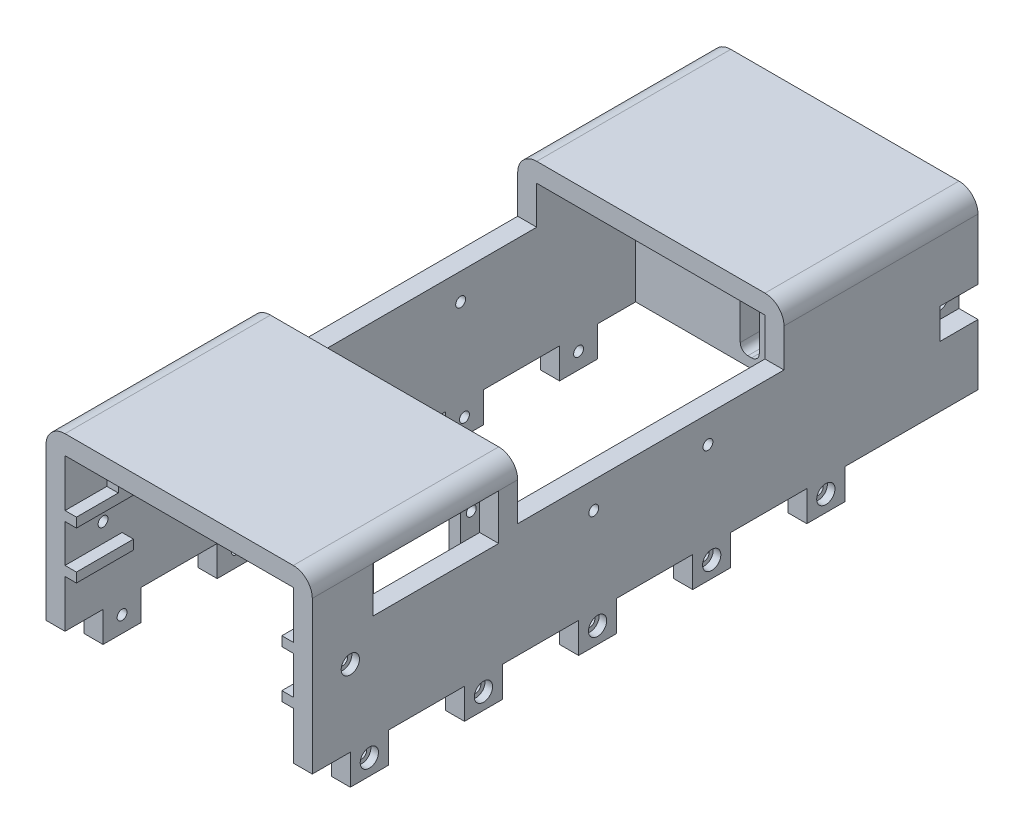
from build123d import *

# Parameters (mm, degrees)
BOSS_EXTRUDE1_DEPTH = 175
SKETCH2_W           = 10
SKETCH2_H           = 8
SKETCH2_R           = 2.4
SKETCH2_R_2         = 1.3
BOSS_EXTRUDE2_DEPTH = 5
SKETCH2_3_R         = 2.4
SKETCH2_3_R_2       = 1.3
CUT_EXTRUDE1_DEPTH  = 2
SKETCH4_W           = 12
SKETCH4_H           = 12
SKETCH4_R           = 1.95
BOSS_EXTRUDE3_DEPTH = 5
SKETCH6_W           = 5
SKETCH6_H           = 8
CUT_EXTRUDE4_DEPTH  = 10
SKETCH7_W           = 70
SKETCH7_H           = 70
CUT_EXTRUDE5_DEPTH  = 15
CUT_EXTRUDE6_REACH  = 204.855
SKETCH9_R           = 1.3
CUT_EXTRUDE15_REACH = 204.855
SKETCH18_R          = 1.3
SKETCH18_3_R        = 2.4
CUT_EXTRUDE16_DEPTH = 2
BOSS_EXTRUDE4_REACH = 195.585
BULKHEAD_W          = 60
BULKHEAD_H          = 10
CUT_EXTRUDE17_REACH = 204.855
SKETCH20_W          = 33
SKETCH20_H          = 12
SKETCH21_W          = 10.1
SKETCH21_H          = 15
SKETCH21_R          = 1.3
BOSS_EXTRUDE6_DEPTH = 3
CUT_EXTRUDE18_DEPTH = 10
SKETCH23_W          = 11
SKETCH23_H          = 2.5
SKETCH23_W_2        = 15
BOSS_EXTRUDE7_DEPTH = 3


with BuildPart() as part:
    # Body Arch → Boss-Extrude1 (new body)
    with BuildSketch(Plane.XY.offset(10)):
        with BuildLine():
            Line((-30, 40), (30, 40))
            Line((30, 40), (30, 0))
            Line((30, 0), (35, 0))
            Line((35, 0), (35, 40))
            ThreePointArc((35, 40), (33.535533906, 43.535533906), (30, 45))
            Line((30, 45), (-30, 45))
            ThreePointArc((-30, 45), (-33.535533906, 43.535533906), (-35, 40))
            Line((-35, 40), (-35, 0))
            Line((-35, 0), (-30, 0))
            Line((-30, 0), (-30, 40))
        make_face()
    extrude(amount=BOSS_EXTRUDE1_DEPTH)

    # Sketch2 → Boss-Extrude2 (add)
    # profile 1 of 10: a face of its own
    with BuildSketch(Plane(origin=(35, 0, 0), x_dir=(0, 0, -1), z_dir=(1, 0, 0))):
        with Locations((-170, -4)):
            Rectangle(SKETCH2_W, SKETCH2_H)
        with Locations((-170, -3.75)):
            Circle(SKETCH2_R, mode=Mode.SUBTRACT)
    # profile 2 of 10: a face of its own
    with BuildSketch(Plane(origin=(35, 0, 0), x_dir=(0, 0, -1), z_dir=(1, 0, 0))):
        with Locations((-140, -4)):
            Rectangle(SKETCH2_W, SKETCH2_H)
        with Locations((-140, -3.75)):
            Circle(SKETCH2_R, mode=Mode.SUBTRACT)
    # profile 3 of 10: a face of its own
    with BuildSketch(Plane(origin=(35, 0, 0), x_dir=(0, 0, -1), z_dir=(1, 0, 0))):
        with Locations((-110, -4)):
            Rectangle(SKETCH2_W, SKETCH2_H)
        with Locations((-110, -3.75)):
            Circle(SKETCH2_R, mode=Mode.SUBTRACT)
    # profile 4 of 10: a face of its own
    with BuildSketch(Plane(origin=(35, 0, 0), x_dir=(0, 0, -1), z_dir=(1, 0, 0))):
        with Locations((-80, -4)):
            Rectangle(SKETCH2_W, SKETCH2_H)
        with Locations((-80, -3.75)):
            Circle(SKETCH2_R, mode=Mode.SUBTRACT)
    # profile 5 of 10: a face of its own
    with BuildSketch(Plane(origin=(35, 0, 0), x_dir=(0, 0, -1), z_dir=(1, 0, 0))):
        with Locations((-50, -4)):
            Rectangle(SKETCH2_W, SKETCH2_H)
        with Locations((-50, -3.75)):
            Circle(SKETCH2_R, mode=Mode.SUBTRACT)
    # profile 6 of 10: a face of its own
    with BuildSketch(Plane(origin=(35, 0, 0), x_dir=(0, 0, -1), z_dir=(1, 0, 0))):
        with Locations((-170, -3.75)):
            Circle(SKETCH2_R)
        with Locations((-170, -3.75)):
            Circle(SKETCH2_R_2, mode=Mode.SUBTRACT)
    # profile 7 of 10: a face of its own
    with BuildSketch(Plane(origin=(35, 0, 0), x_dir=(0, 0, -1), z_dir=(1, 0, 0))):
        with Locations((-140, -3.75)):
            Circle(SKETCH2_R)
        with Locations((-140, -3.75)):
            Circle(SKETCH2_R_2, mode=Mode.SUBTRACT)
    # profile 8 of 10: a face of its own
    with BuildSketch(Plane(origin=(35, 0, 0), x_dir=(0, 0, -1), z_dir=(1, 0, 0))):
        with Locations((-110, -3.75)):
            Circle(SKETCH2_R)
        with Locations((-110, -3.75)):
            Circle(SKETCH2_R_2, mode=Mode.SUBTRACT)
    # profile 9 of 10: a face of its own
    with BuildSketch(Plane(origin=(35, 0, 0), x_dir=(0, 0, -1), z_dir=(1, 0, 0))):
        with Locations((-80, -3.75)):
            Circle(SKETCH2_R)
        with Locations((-80, -3.75)):
            Circle(SKETCH2_R_2, mode=Mode.SUBTRACT)
    # profile 10 of 10: a face of its own
    with BuildSketch(Plane(origin=(35, 0, 0), x_dir=(0, 0, -1), z_dir=(1, 0, 0))):
        with Locations((-50, -3.75)):
            Circle(SKETCH2_R)
        with Locations((-50, -3.75)):
            Circle(SKETCH2_R_2, mode=Mode.SUBTRACT)
    boss_extrude2 = extrude(amount=-BOSS_EXTRUDE2_DEPTH)

    # Sketch2<3> → Cut-Extrude1 (cut)
    # profile 1 of 5: a face of its own
    with BuildSketch(Plane(origin=(35, 0, 0), x_dir=(0, 0, -1), z_dir=(1, 0, 0))):
        with Locations((-170, -3.75)):
            Circle(SKETCH2_3_R)
        with Locations((-170, -3.75)):
            Circle(SKETCH2_3_R_2, mode=Mode.SUBTRACT)
    # profile 2 of 5: a face of its own
    with BuildSketch(Plane(origin=(35, 0, 0), x_dir=(0, 0, -1), z_dir=(1, 0, 0))):
        with Locations((-140, -3.75)):
            Circle(SKETCH2_3_R)
        with Locations((-140, -3.75)):
            Circle(SKETCH2_3_R_2, mode=Mode.SUBTRACT)
    # profile 3 of 5: a face of its own
    with BuildSketch(Plane(origin=(35, 0, 0), x_dir=(0, 0, -1), z_dir=(1, 0, 0))):
        with Locations((-110, -3.75)):
            Circle(SKETCH2_3_R)
        with Locations((-110, -3.75)):
            Circle(SKETCH2_3_R_2, mode=Mode.SUBTRACT)
    # profile 4 of 5: a face of its own
    with BuildSketch(Plane(origin=(35, 0, 0), x_dir=(0, 0, -1), z_dir=(1, 0, 0))):
        with Locations((-80, -3.75)):
            Circle(SKETCH2_3_R)
        with Locations((-80, -3.75)):
            Circle(SKETCH2_3_R_2, mode=Mode.SUBTRACT)
    # profile 5 of 5: a face of its own
    with BuildSketch(Plane(origin=(35, 0, 0), x_dir=(0, 0, -1), z_dir=(1, 0, 0))):
        with Locations((-50, -3.75)):
            Circle(SKETCH2_3_R)
        with Locations((-50, -3.75)):
            Circle(SKETCH2_3_R_2, mode=Mode.SUBTRACT)
    cut_extrude1 = extrude(amount=-CUT_EXTRUDE1_DEPTH, mode=Mode.SUBTRACT)

    # Mirror1: Boss-Extrude2, Cut-Extrude1 across plane
    add(boss_extrude2.mirror(Plane(origin=(0, 0, 0), x_dir=(0, 0, 1), z_dir=(1, 0, 0))))
    add(cut_extrude1.mirror(Plane(origin=(0, 0, 0), x_dir=(0, 0, 1), z_dir=(1, 0, 0))), mode=Mode.SUBTRACT)

    # Sketch4 → Boss-Extrude3 (add)
    with BuildSketch(Plane.ZY.offset(-30)):
        with Locations((16, 20)):
            Rectangle(SKETCH4_W, SKETCH4_H)
        with Locations(Location((15, 20, 0), (0, 0, 270))):
            Circle(SKETCH4_R, mode=Mode.SUBTRACT)
    boss_extrude3 = extrude(amount=BOSS_EXTRUDE3_DEPTH)

    # Sketch6 → Cut-Extrude4 (cut)
    with BuildSketch(Plane(origin=(0, 0, 10), x_dir=(-1, 0, 0), z_dir=(0, 0, -1))):
        with Locations((-32.5, 20)):
            Rectangle(SKETCH6_W, SKETCH6_H)
    cut_extrude4 = extrude(amount=-CUT_EXTRUDE4_DEPTH, mode=Mode.SUBTRACT)

    # Mirror2: Boss-Extrude3, Cut-Extrude4 across plane
    add(boss_extrude3.mirror(Plane(origin=(0, 0, 0), x_dir=(0, 0, 1), z_dir=(1, 0, 0))))
    add(cut_extrude4.mirror(Plane(origin=(0, 0, 0), x_dir=(0, 0, 1), z_dir=(1, 0, 0))), mode=Mode.SUBTRACT)

    # Sketch7 → Cut-Extrude5 (cut)
    with BuildSketch(Plane(origin=(0, 45, 0), x_dir=(1, 0, 0), z_dir=(0, 1, 0))):
        with Locations((0, -96)):
            Rectangle(SKETCH7_W, SKETCH7_H)
    extrude(amount=-CUT_EXTRUDE5_DEPTH, mode=Mode.SUBTRACT)

    # Sketch9 → Cut-Extrude6 (cut, up to next)
    with BuildSketch(Plane(origin=(35, 0, 0), x_dir=(0, 0, -1), z_dir=(1, 0, 0)), mode=Mode.PRIVATE) as cut_extrude6_sk1:
        with Locations((-81, 23)):
            Circle(SKETCH9_R)
    cut_extrude6_tool1 = extrude(cut_extrude6_sk1.sketch, amount=-CUT_EXTRUDE6_REACH, mode=Mode.PRIVATE) & part.part
    # Sketch9 → Cut-Extrude6 (cut, up to next)
    with BuildSketch(Plane(origin=(35, 0, 0), x_dir=(0, 0, -1), z_dir=(1, 0, 0)), mode=Mode.PRIVATE) as cut_extrude6_sk2:
        with Locations((-111, 23)):
            Circle(SKETCH9_R)
    cut_extrude6_tool2 = extrude(cut_extrude6_sk2.sketch, amount=-CUT_EXTRUDE6_REACH, mode=Mode.PRIVATE) & part.part
    cut_extrude6_1 = cut_extrude6_tool1.solids().sort_by_distance((35, 23, 81))[0]
    add(cut_extrude6_1, mode=Mode.SUBTRACT)
    cut_extrude6_2 = cut_extrude6_tool2.solids().sort_by_distance((35, 23, 111))[0]
    add(cut_extrude6_2, mode=Mode.SUBTRACT)
    cut_extrude6 = cut_extrude6_1 + cut_extrude6_2  # Cut-Extrude6 as one shape, for the pattern or mirror that repeats it

    # Mirror4: Cut-Extrude6 across plane
    add(cut_extrude6.mirror(Plane(origin=(0, 0, 0), x_dir=(0, 0, 1), z_dir=(1, 0, 0))), mode=Mode.SUBTRACT)

    # Sketch18 → Cut-Extrude15 (cut, up to next)
    with BuildSketch(Plane(origin=(35, 0, 0), x_dir=(0, 0, -1), z_dir=(1, 0, 0)), mode=Mode.PRIVATE) as cut_extrude15_sk1:
        with Locations((-175, 20)):
            Circle(SKETCH18_R)
    cut_extrude15_tool1 = extrude(cut_extrude15_sk1.sketch, amount=-CUT_EXTRUDE15_REACH, mode=Mode.PRIVATE) & part.part
    cut_extrude15 = cut_extrude15_tool1.solids().sort_by_distance((35, 20, 175))[0]
    add(cut_extrude15, mode=Mode.SUBTRACT)

    # Sketch18<3> → Cut-Extrude16 (cut)
    with BuildSketch(Plane(origin=(35, 0, 0), x_dir=(0, 0, -1), z_dir=(1, 0, 0))):
        with Locations((-175, 20)):
            Circle(SKETCH18_3_R)
    cut_extrude16 = extrude(amount=-CUT_EXTRUDE16_DEPTH, mode=Mode.SUBTRACT)

    # Mirror6: Cut-Extrude15, Cut-Extrude16 across plane
    add(cut_extrude15.mirror(Plane(origin=(0, 0, 0), x_dir=(0, 0, 1), z_dir=(1, 0, 0))), mode=Mode.SUBTRACT)
    add(cut_extrude16.mirror(Plane(origin=(0, 0, 0), x_dir=(0, 0, 1), z_dir=(1, 0, 0))), mode=Mode.SUBTRACT)

    # Bulkhead → Boss-Extrude4 (add, up to next)
    with BuildSketch(Plane(origin=(0, 0, 0), x_dir=(1, 0, 0), z_dir=(0, 1, 0)), mode=Mode.PRIVATE) as boss_extrude4_sk1:
        with Locations((0, -30)):
            Rectangle(BULKHEAD_W, BULKHEAD_H)
    boss_extrude4_tool1 = extrude(boss_extrude4_sk1.sketch, amount=BOSS_EXTRUDE4_REACH, mode=Mode.PRIVATE) - part.part
    add(boss_extrude4_tool1.solids().sort_by_distance((0, 0, 30))[0])

    # Sketch20 → Cut-Extrude17 (cut, up to next)
    with BuildSketch(Plane.ZY.offset(35), mode=Mode.PRIVATE) as cut_extrude17_sk1:
        with Locations((152.5, 34)):
            Rectangle(SKETCH20_W, SKETCH20_H)
    cut_extrude17_tool1 = extrude(cut_extrude17_sk1.sketch, amount=-CUT_EXTRUDE17_REACH, mode=Mode.PRIVATE) & part.part
    cut_extrude17 = cut_extrude17_tool1.solids().sort_by_distance((-35, 34, 152.5))[0]
    add(cut_extrude17, mode=Mode.SUBTRACT)

    # Sketch21 → Boss-Extrude6 (add)
    # profile 1 of 2: a face of its own
    with BuildSketch(Plane(origin=(-30, 0, 0), x_dir=(0, 0, -1), z_dir=(1, 0, 0))):
        with Locations((-136.05, 32.5)):
            Rectangle(SKETCH21_W, SKETCH21_H)
        with Locations((-138.2, 34)):
            Circle(SKETCH21_R, mode=Mode.SUBTRACT)
    # profile 2 of 2: a face of its own
    with BuildSketch(Plane(origin=(-30, 0, 0), x_dir=(0, 0, -1), z_dir=(1, 0, 0))):
        with Locations((-168.95, 32.5)):
            Rectangle(SKETCH21_W, SKETCH21_H)
        with Locations(Location((-166.8, 34, 0), (0, 0, 180))):
            Circle(SKETCH21_R, mode=Mode.SUBTRACT)
    boss_extrude6 = extrude(amount=BOSS_EXTRUDE6_DEPTH)

    # Sketch22 → Cut-Extrude18 (cut)
    with BuildSketch(Plane(origin=(0, 0, 25), x_dir=(-1, 0, 0), z_dir=(0, 0, -1))):
        with BuildLine():
            Line((-15.5, 22.5), (15.5, 22.5))
            ThreePointArc((15.5, 22.5), (16.914213562, 21.914213562), (17.5, 20.5))
            Line((17.5, 20.5), (17.5, 19.5))
            ThreePointArc((17.5, 19.5), (16.914213562, 18.085786438), (15.5, 17.5))
            Line((15.5, 17.5), (-15.5, 17.5))
            ThreePointArc((-15.5, 17.5), (-16.914213562, 18.085786438), (-17.5, 19.5))
            Line((-17.5, 19.5), (-17.5, 20.5))
            ThreePointArc((-17.5, 20.5), (-16.914213562, 21.914213562), (-15.5, 22.5))
        make_face()
        with BuildLine():
            Line((-0.5, 37.5), (0.5, 37.5))
            ThreePointArc((0.5, 37.5), (1.914213562, 36.914213562), (2.5, 35.5))
            Line((2.5, 35.5), (2.5, 4.5))
            ThreePointArc((2.5, 4.5), (1.914213562, 3.085786438), (0.5, 2.5))
            Line((0.5, 2.5), (-0.5, 2.5))
            ThreePointArc((-0.5, 2.5), (-1.914213562, 3.085786438), (-2.5, 4.5))
            Line((-2.5, 4.5), (-2.5, 35.5))
            ThreePointArc((-2.5, 35.5), (-1.914213562, 36.914213562), (-0.5, 37.5))
        make_face()
    extrude(amount=-CUT_EXTRUDE18_DEPTH, mode=Mode.SUBTRACT)

    # Sketch23 → Boss-Extrude7 (add)
    with BuildSketch(Plane(origin=(-30, 0, 0), x_dir=(0, 0, -1), z_dir=(1, 0, 0))):
        with Locations((-179.5, 26.25)):
            Rectangle(SKETCH23_W, SKETCH23_H)
        with Locations((-177.5, 13.75)):
            Rectangle(SKETCH23_W_2, SKETCH23_H)
    boss_extrude7 = extrude(amount=BOSS_EXTRUDE7_DEPTH)

    # Mirror7: Cut-Extrude17, Boss-Extrude6, Boss-Extrude7 across plane
    add(cut_extrude17.mirror(Plane(origin=(0, 0, 0), x_dir=(0, 0, 1), z_dir=(1, 0, 0))), mode=Mode.SUBTRACT)
    add(boss_extrude6.mirror(Plane(origin=(0, 0, 0), x_dir=(0, 0, 1), z_dir=(1, 0, 0))))
    add(boss_extrude7.mirror(Plane(origin=(0, 0, 0), x_dir=(0, 0, 1), z_dir=(1, 0, 0))))


solid = part.part
